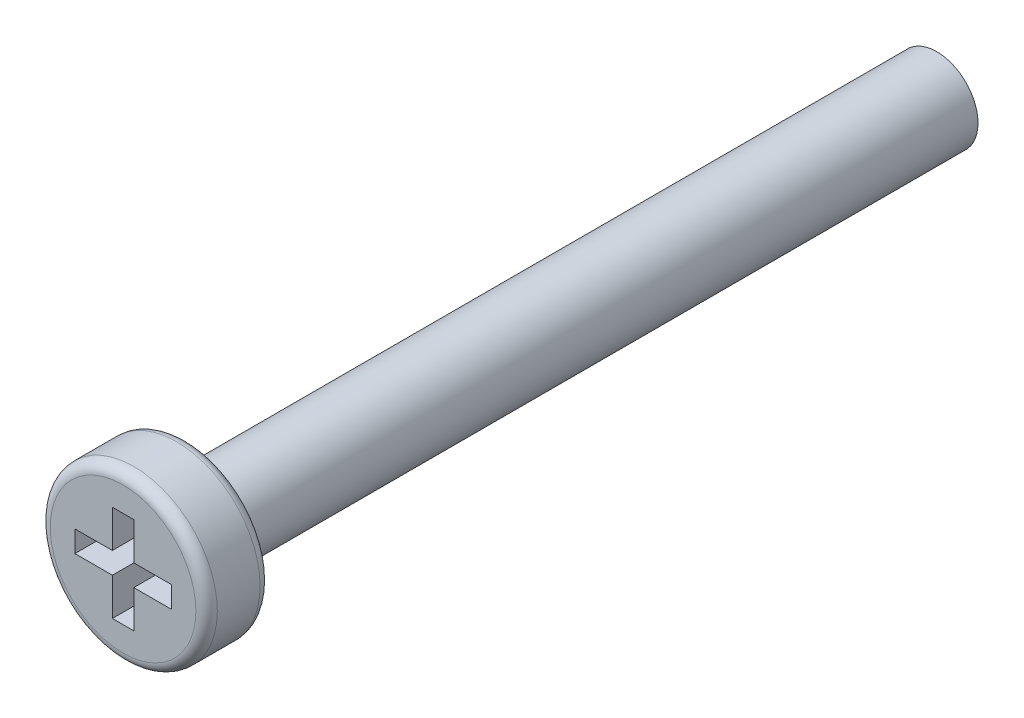
from build123d import *

# Parameters (mm, degrees)
ESBO_O5_R                = 3.9
RESSALTO_EXTRUS_O2_DEPTH = 3
CORTE_EXTRUS_O3_DEPTH    = 2
FILETE1_R                = 0.5
ESBO_O8_R                = 1.925
RESSALTO_EXTRUS_O3_DEPTH = 35


with BuildPart() as part:
    # Esboço5 → Ressalto-extrusão2 (new body)
    with BuildSketch(Plane.XY):
        Circle(ESBO_O5_R)
    extrude(amount=RESSALTO_EXTRUS_O2_DEPTH)

    # Esboço7 → Corte-extrusão3 (cut)
    with BuildSketch(Plane.XY.offset(3)):
        Polygon((-0.5, -0.5), (-2.25, -0.5), (-2.25, 0.5), (-0.5, 0.5), (-0.5, 2.25), (0.5, 2.25), (0.5, 0.5), (2.25, 0.5), (2.25, -0.5), (0.5, -0.5), (0.5, -2.25), (-0.5, -2.25), align=None)
    extrude(amount=-CORTE_EXTRUS_O3_DEPTH, mode=Mode.SUBTRACT)

    # Filete1
    filete1_edges = [part.edges().sort_by_distance(p)[0] for p in [
        (-3.9, 0, 0),
        (-3.9, 0, 3),
    ]]
    fillet(filete1_edges, radius=FILETE1_R)

    # Esboço8 → Ressalto-extrusão3 (add)
    with BuildSketch(Plane(origin=(0, 0, 0), x_dir=(-1, 0, 0), z_dir=(0, 0, -1))):
        with Locations(Location((0, 0, 0), (0, 0, 180))):
            Circle(ESBO_O8_R)
    extrude(amount=RESSALTO_EXTRUS_O3_DEPTH)


solid = part.part
